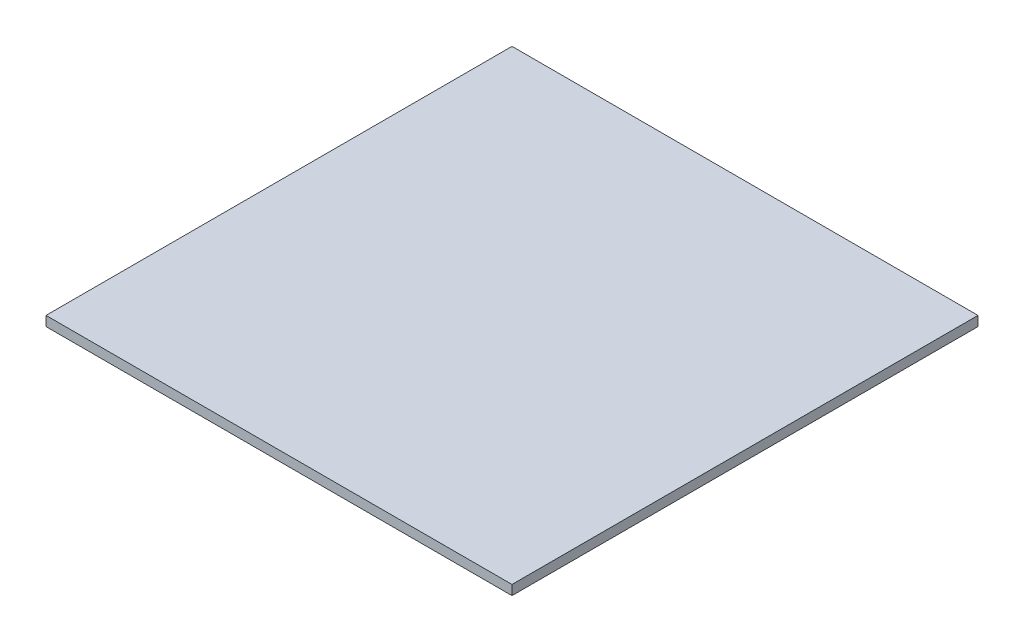
from build123d import *

# Parameters (mm, degrees)
BOSS_EXTRUDE1_DEPTH      = 76.2
BOSS_EXTRUDE1_DEPTH_BACK = 76.2
SKETCH3_W                = 152.4
SKETCH3_H                = 3.175


with BuildPart() as part:
    # Sketch3 → Boss-Extrude1 (new, two sides: drawn at the far end of the back side and taken through both)
    with BuildSketch(Plane.XY.offset(-BOSS_EXTRUDE1_DEPTH_BACK)):
        Rectangle(SKETCH3_W, SKETCH3_H)
    extrude(amount=BOSS_EXTRUDE1_DEPTH + BOSS_EXTRUDE1_DEPTH_BACK)


solid = part.part
